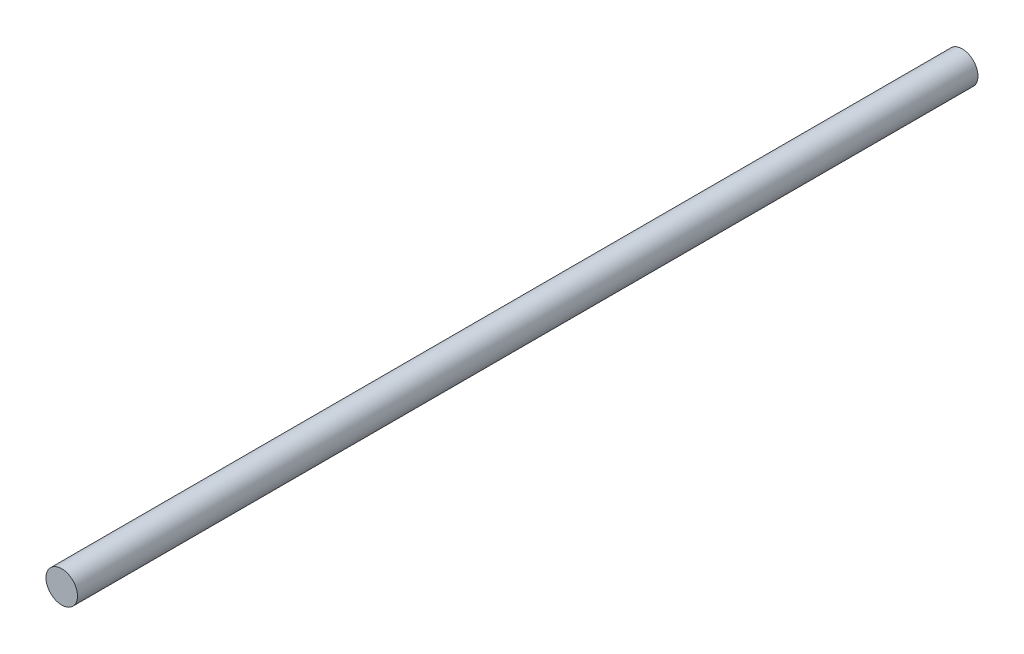
from build123d import *

# Parameters (mm, degrees)
SKETCH1_R           = 7
BOSS_EXTRUDE1_DEPTH = 400


with BuildPart() as part:
    # Sketch1 → Boss-Extrude1 (new body)
    with BuildSketch(Plane.XY):
        with Locations((-20, 0)):
            Circle(SKETCH1_R)
    extrude(amount=BOSS_EXTRUDE1_DEPTH)


solid = part.part
